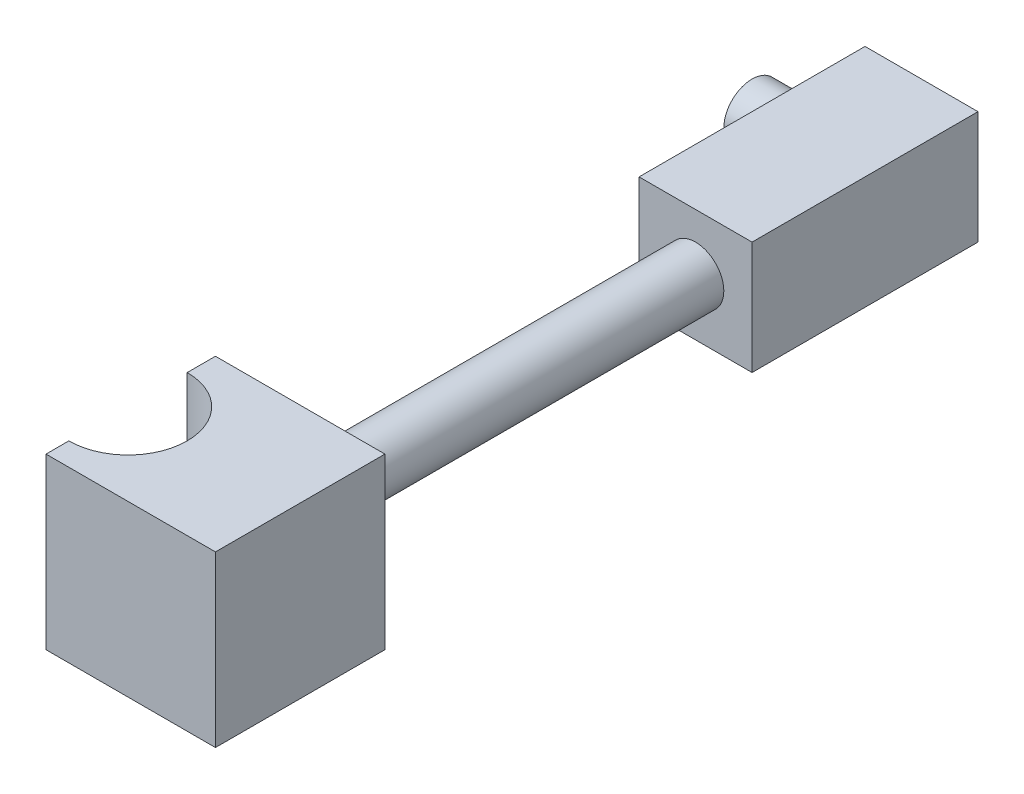
from build123d import *

# Parameters (mm, degrees)
SKETCH1_W           = 20
SKETCH1_H           = 40
BOSS_EXTRUDE1_DEPTH = 20
SKETCH2_R           = 5
BOSS_EXTRUDE2_DEPTH = 10
SKETCH3_R           = 5
BOSS_EXTRUDE3_DEPTH = 70
SKETCH4_W           = 30
SKETCH4_H           = 30
BOSS_EXTRUDE4_DEPTH = 30
CUT_EXTRUDE1_DEPTH  = 30


with BuildPart() as part:
    # Sketch1 → Boss-Extrude1 (new body)
    with BuildSketch(Plane(origin=(0, 0, 0), x_dir=(1, 0, 0), z_dir=(0, 1, 0))):
        with Locations((3.516483516, 1.923076923)):
            Rectangle(SKETCH1_W, SKETCH1_H)
    extrude(amount=BOSS_EXTRUDE1_DEPTH)

    # Sketch2 → Boss-Extrude2 (add)
    with BuildSketch(Plane.ZY.offset(6.483516484)):
        with Locations(Location((-11.923076923, 10, 0), (0, 0, 180))):
            Circle(SKETCH2_R)
    extrude(amount=BOSS_EXTRUDE2_DEPTH)

    # Sketch3 → Boss-Extrude3 (add)
    with BuildSketch(Plane.XY.offset(18.076923077)):
        with Locations((3.516483516, 10)):
            Circle(SKETCH3_R)
    extrude(amount=BOSS_EXTRUDE3_DEPTH)

    # Sketch4 → Boss-Extrude4 (add)
    with BuildSketch(Plane.XY.offset(88.076923077)):
        with Locations((3.516483516, 10)):
            Rectangle(SKETCH4_W, SKETCH4_H)
    extrude(amount=BOSS_EXTRUDE4_DEPTH)

    # Sketch7 → Cut-Extrude1 (cut)
    with BuildSketch(Plane(origin=(0, 25, 0), x_dir=(1, 0, 0), z_dir=(0, 1, 0))):
        with BuildLine():
            ThreePointArc((-11.483516484, -114.035823302), (-1.004066371, -103.55637319), (-11.483516484, -93.076923077))
            Line((-11.483516484, -93.076923077), (-11.483516484, -114.035823302))
        make_face()
    extrude(amount=-CUT_EXTRUDE1_DEPTH, mode=Mode.SUBTRACT)


solid = part.part
